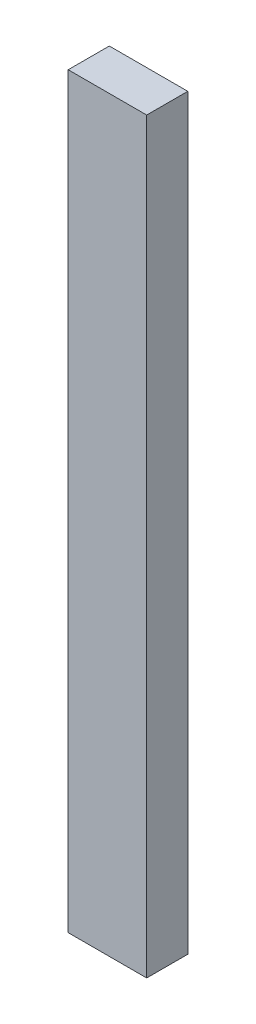
from build123d import *

# Parameters (mm, degrees)
SKETCH1_W           = 126
SKETCH1_H           = 66
SKETCH1_W_2         = 120
SKETCH1_H_2         = 60
EXTRUDE_THIN1_DEPTH = 600
SKETCH2_W           = 120
SKETCH2_H           = 60
BOSS_EXTRUDE1_DEPTH = 3


with BuildPart() as part:
    # Sketch1 → Extrude-Thin1 (new, symmetric)
    with BuildSketch(Plane(origin=(0, 0, 0), x_dir=(1, 0, 0), z_dir=(0, 1, 0))):
        Rectangle(SKETCH1_W, SKETCH1_H)
        Rectangle(SKETCH1_W_2, SKETCH1_H_2, mode=Mode.SUBTRACT)
    extrude(amount=EXTRUDE_THIN1_DEPTH, both=True)

    # Sketch2 → Boss-Extrude1 (add)
    with BuildSketch(Plane(origin=(0, 600, 0), x_dir=(1, 0, 0), z_dir=(0, 1, 0))):
        Rectangle(SKETCH2_W, SKETCH2_H)
    extrude(amount=-BOSS_EXTRUDE1_DEPTH)


solid = part.part
